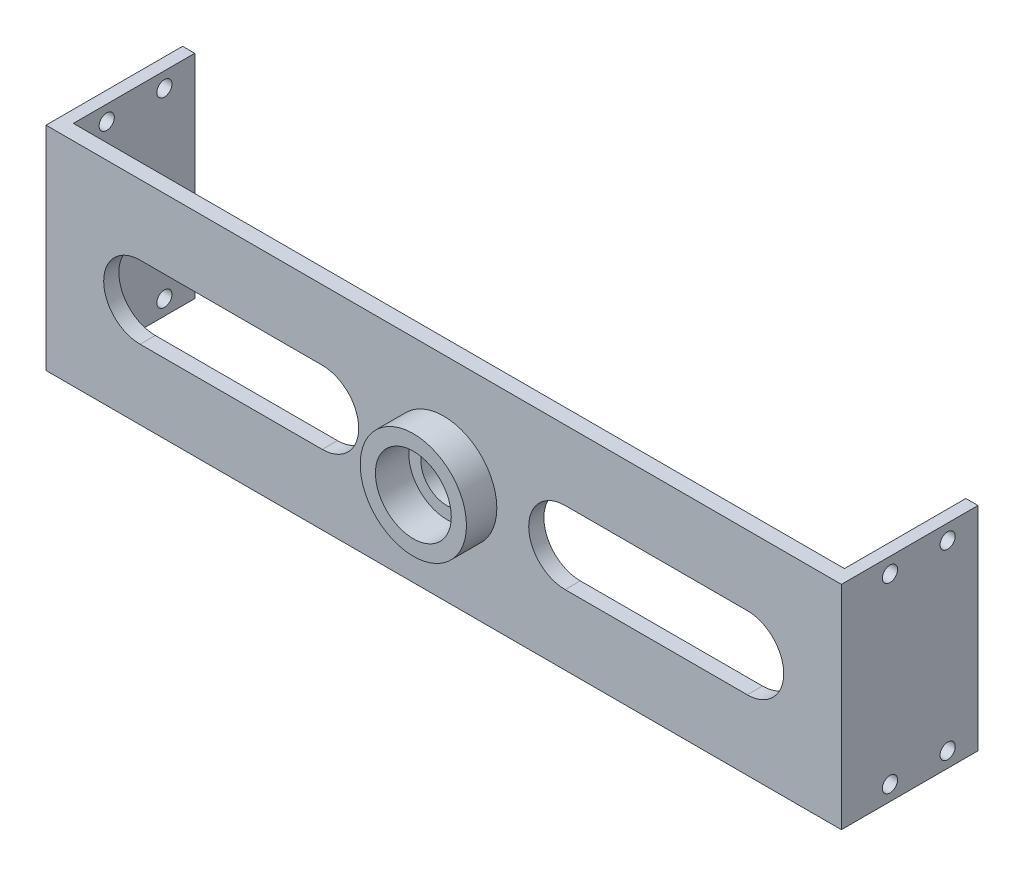
from build123d import *

# Parameters (mm, degrees)
ESQUISSE1_W             = 254
ESQUISSE1_H             = 70
BOSS_EXTRU_1_DEPTH      = 5
ESQUISSE2_R             = 12.5
ENL_V_MAT_EXTRU_1_DEPTH = 132.829435256
BOSS_EXTRU_2_START      = 10
ESQUISSE3_R             = 17.5
ESQUISSE3_R_2           = 12.5
BOSS_EXTRU_2_DEPTH      = 10
ENL_V_MAT_EXTRU_2_DEPTH = 133.113587492
ESQUISSE5_W             = 45
ESQUISSE5_H             = 70
BOSS_EXTRU_3_DEPTH      = 4
ESQUISSE6_W             = 45
ESQUISSE6_H             = 70
BOSS_EXTRU_4_DEPTH      = 4
ESQUISSE7_R             = 2.5
ENL_V_MAT_EXTRU_3_DEPTH = 268.336866145
BOSS_EXTRU_5_START      = -4
ESQUISSE8_R             = 12.5
ESQUISSE8_R_2           = 8.5
BOSS_EXTRU_5_DEPTH      = 4


with BuildPart() as part:
    # Esquisse1 → Boss.-Extru.1 (new body)
    with BuildSketch(Plane.XY):
        Rectangle(ESQUISSE1_W, ESQUISSE1_H)
    extrude(amount=BOSS_EXTRU_1_DEPTH)

    # Esquisse2 → Enlèv. mat.-Extru.1 (cut, through all)
    with BuildSketch(Plane.XY.offset(5)):
        Circle(ESQUISSE2_R)
    extrude(amount=-ENL_V_MAT_EXTRU_1_DEPTH, mode=Mode.SUBTRACT)

    # Esquisse3 → Boss.-Extru.2 (add)
    with BuildSketch(Plane.XY.offset(5).offset(BOSS_EXTRU_2_START)):
        Circle(ESQUISSE3_R)
        Circle(ESQUISSE3_R_2, mode=Mode.SUBTRACT)
    extrude(amount=-BOSS_EXTRU_2_DEPTH)

    # Esquisse4 → Enlèv. mat.-Extru.2 (cut, through all)
    with BuildSketch(Plane.XY.offset(5)):
        with BuildLine():
            Line((-100, 12), (-40, 12))
            ThreePointArc((-40, 12), (-28, 0), (-40, -12))
            Line((-40, -12), (-100, -12))
            ThreePointArc((-100, -12), (-112, 0), (-100, 12))
        make_face()
        with BuildLine():
            Line((100, 12), (40, 12))
            ThreePointArc((40, 12), (28, 0), (40, -12))
            Line((40, -12), (100, -12))
            ThreePointArc((100, -12), (112, 0), (100, 12))
        make_face()
    extrude(amount=-ENL_V_MAT_EXTRU_2_DEPTH, mode=Mode.SUBTRACT)

    # Esquisse5 → Boss.-Extru.3 (add)
    with BuildSketch(Plane.ZY.offset(127)):
        with Locations((-17.5, 0)):
            Rectangle(ESQUISSE5_W, ESQUISSE5_H)
    extrude(amount=BOSS_EXTRU_3_DEPTH)

    # Esquisse6 → Boss.-Extru.4 (add)
    with BuildSketch(Plane(origin=(127, 0, 0), x_dir=(0, 0, -1), z_dir=(1, 0, 0))):
        with Locations((17.5, 0)):
            Rectangle(ESQUISSE6_W, ESQUISSE6_H)
    extrude(amount=BOSS_EXTRU_4_DEPTH)

    # Esquisse7 → Enlèv. mat.-Extru.3 (cut, through all)
    with BuildSketch(Plane.ZY.offset(131)):
        with Locations((-11, 30)):
            Circle(ESQUISSE7_R)
        with Locations((-11, -30)):
            Circle(ESQUISSE7_R)
        with Locations((-30, 30)):
            Circle(ESQUISSE7_R)
        with Locations((-30, -30)):
            Circle(ESQUISSE7_R)
    extrude(amount=-ENL_V_MAT_EXTRU_3_DEPTH, mode=Mode.SUBTRACT)

    # Esquisse8 → Boss.-Extru.5 (add)
    with BuildSketch(Plane(origin=(0, 0, 0), x_dir=(-1, 0, 0), z_dir=(0, 0, -1)).offset(BOSS_EXTRU_5_START)):
        with Locations(Location((0, 0, 0), (0, 0, 180))):
            Circle(ESQUISSE8_R)
        Circle(ESQUISSE8_R_2, mode=Mode.SUBTRACT)
    extrude(amount=BOSS_EXTRU_5_DEPTH)


solid = part.part
